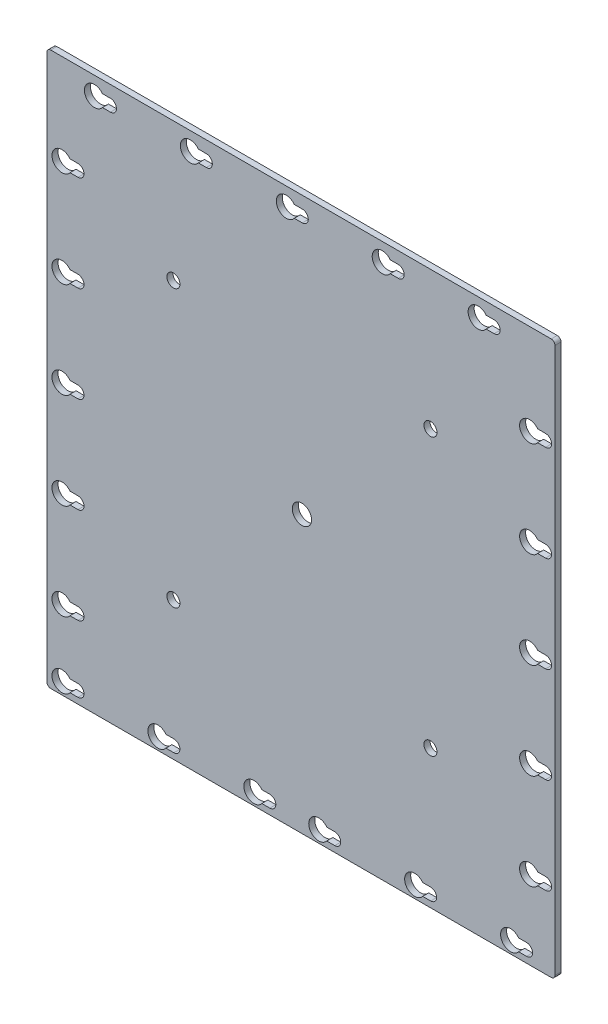
from build123d import *

# Parameters (mm, degrees)
SKETCH1_W               = 135.01974
SKETCH1_H               = 146.431289
SKETCH1_R               = 2.5527
BOSS_EXTRUDE1_DEPTH     = 1.6
SKETCH3_W               = 0.5
SKETCH3_H               = 146.431289
CUT_EXTRUDE1_DEPTH      = 1.6
FILLET1_R               = 1
CUT_EXTRUDE2_DEPTH      = 199.847285241
CUT_EXTRUDE2_DEPTH_BACK = 199.847285241
SKETCH4_R               = 1.725


with BuildPart() as part:
    # Sketch1 → Boss-Extrude1 (new body)
    with BuildSketch(Plane.XY):
        with Locations((67.50987, -73.2156445)):
            Rectangle(SKETCH1_W, SKETCH1_H)
        with BuildLine():
            Line((65.489272699, -3.175), (67.6049, -3.175))
            ThreePointArc((67.6049, -3.175), (69.1924, -4.7625), (67.6049, -6.35))
            Line((67.6049, -6.35), (65.489272699, -6.35))
            ThreePointArc((65.489272699, -6.35), (60.7174, -4.7625), (65.489272699, -3.175))
        make_face(mode=Mode.SUBTRACT)
        with Locations((67.50987, -73.2156445)):
            Circle(SKETCH1_R, mode=Mode.SUBTRACT)
        with BuildLine():
            Line((6.094272699, -141.668789), (8.2099, -141.668789))
            ThreePointArc((8.2099, -141.668789), (9.7974, -143.256289), (8.2099, -144.843789))
            Line((8.2099, -144.843789), (6.094272699, -144.843789))
            ThreePointArc((6.094272699, -144.843789), (1.3224, -143.256289), (6.094272699, -141.668789))
        make_face(mode=Mode.SUBTRACT)
        with BuildLine():
            Line((31.494272699, -141.668789), (33.6099, -141.668789))
            ThreePointArc((33.6099, -141.668789), (35.1974, -143.256289), (33.6099, -144.843789))
            Line((33.6099, -144.843789), (31.494272699, -144.843789))
            ThreePointArc((31.494272699, -144.843789), (26.7224, -143.256289), (31.494272699, -141.668789))
        make_face(mode=Mode.SUBTRACT)
        with BuildLine():
            Line((6.094244639, -124.015625), (8.20987194, -124.015625))
            ThreePointArc((8.20987194, -124.015625), (9.79737194, -125.603125), (8.20987194, -127.190625))
            Line((8.20987194, -127.190625), (6.094244639, -127.190625))
            ThreePointArc((6.094244639, -127.190625), (1.32237194, -125.603125), (6.094244639, -124.015625))
        make_face(mode=Mode.SUBTRACT)
        with BuildLine():
            Line((56.894272699, -141.668789), (59.0099, -141.668789))
            ThreePointArc((59.0099, -141.668789), (60.5974, -143.256289), (59.0099, -144.843789))
            Line((59.0099, -144.843789), (56.894272699, -144.843789))
            ThreePointArc((56.894272699, -144.843789), (52.1224, -143.256289), (56.894272699, -141.668789))
        make_face(mode=Mode.SUBTRACT)
        with BuildLine():
            Line((6.094244639, -98.615625), (8.20987194, -98.615625))
            ThreePointArc((8.20987194, -98.615625), (9.79737194, -100.203125), (8.20987194, -101.790625))
            Line((8.20987194, -101.790625), (6.094244639, -101.790625))
            ThreePointArc((6.094244639, -101.790625), (1.32237194, -100.203125), (6.094244639, -98.615625))
        make_face(mode=Mode.SUBTRACT)
        with BuildLine():
            Line((6.094244639, -73.215625), (8.20987194, -73.215625))
            ThreePointArc((8.20987194, -73.215625), (9.79737194, -74.803125), (8.20987194, -76.390625))
            Line((8.20987194, -76.390625), (6.094244639, -76.390625))
            ThreePointArc((6.094244639, -76.390625), (1.32237194, -74.803125), (6.094244639, -73.215625))
        make_face(mode=Mode.SUBTRACT)
        with BuildLine():
            Line((6.094244639, -47.815625), (8.20987194, -47.815625))
            ThreePointArc((8.20987194, -47.815625), (9.79737194, -49.403125), (8.20987194, -50.990625))
            Line((8.20987194, -50.990625), (6.094244639, -50.990625))
            ThreePointArc((6.094244639, -50.990625), (1.32237194, -49.403125), (6.094244639, -47.815625))
        make_face(mode=Mode.SUBTRACT)
        with BuildLine():
            Line((6.094244639, -22.415625), (8.20987194, -22.415625))
            ThreePointArc((8.20987194, -22.415625), (9.79737194, -24.003125), (8.20987194, -25.590625))
            Line((8.20987194, -25.590625), (6.094244639, -25.590625))
            ThreePointArc((6.094244639, -25.590625), (1.32237194, -24.003125), (6.094244639, -22.415625))
        make_face(mode=Mode.SUBTRACT)
        with BuildLine():
            Line((14.689272699, -3.175), (16.8049, -3.175))
            ThreePointArc((16.8049, -3.175), (18.3924, -4.7625), (16.8049, -6.35))
            Line((16.8049, -6.35), (14.689272699, -6.35))
            ThreePointArc((14.689272699, -6.35), (9.9174, -4.7625), (14.689272699, -3.175))
        make_face(mode=Mode.SUBTRACT)
        with BuildLine():
            Line((40.089272699, -3.175), (42.2049, -3.175))
            ThreePointArc((42.2049, -3.175), (43.7924, -4.7625), (42.2049, -6.35))
            Line((42.2049, -6.35), (40.089272699, -6.35))
            ThreePointArc((40.089272699, -6.35), (35.3174, -4.7625), (40.089272699, -3.175))
        make_face(mode=Mode.SUBTRACT)
        with BuildLine():
            Line((118.4049, -6.35), (116.289272699, -6.35))
            ThreePointArc((116.289272699, -6.35), (111.5174, -4.7625), (116.289272699, -3.175))
            Line((116.289272699, -3.175), (118.4049, -3.175))
            ThreePointArc((118.4049, -3.175), (119.9924, -4.7625), (118.4049, -6.35))
        make_face(mode=Mode.SUBTRACT)
        with BuildLine():
            Line((76.20003, -144.843789), (74.084402699, -144.843789))
            ThreePointArc((74.084402699, -144.843789), (69.31253, -143.256289), (74.084402699, -141.668789))
            Line((74.084402699, -141.668789), (76.20003, -141.668789))
            ThreePointArc((76.20003, -141.668789), (77.78753, -143.256289), (76.20003, -144.843789))
        make_face(mode=Mode.SUBTRACT)
        with BuildLine():
            Line((99.484402699, -141.668789), (101.60003, -141.668789))
            ThreePointArc((101.60003, -141.668789), (103.18753, -143.256289), (101.60003, -144.843789))
            Line((101.60003, -144.843789), (99.484402699, -144.843789))
            ThreePointArc((99.484402699, -144.843789), (94.71253, -143.256289), (99.484402699, -141.668789))
        make_face(mode=Mode.SUBTRACT)
        with BuildLine():
            Line((124.884402699, -141.668789), (127.00003, -141.668789))
            ThreePointArc((127.00003, -141.668789), (128.58753, -143.256289), (127.00003, -144.843789))
            Line((127.00003, -144.843789), (124.884402699, -144.843789))
            ThreePointArc((124.884402699, -144.843789), (120.11253, -143.256289), (124.884402699, -141.668789))
        make_face(mode=Mode.SUBTRACT)
        with BuildLine():
            Line((129.919244699, -124.015625), (132.034872, -124.015625))
            ThreePointArc((132.034872, -124.015625), (133.622372, -125.603125), (132.034872, -127.190625))
            Line((132.034872, -127.190625), (129.919244699, -127.190625))
            ThreePointArc((129.919244699, -127.190625), (125.147372, -125.603125), (129.919244699, -124.015625))
        make_face(mode=Mode.SUBTRACT)
        with BuildLine():
            Line((129.919244699, -98.615625), (132.034872, -98.615625))
            ThreePointArc((132.034872, -98.615625), (133.622372, -100.203125), (132.034872, -101.790625))
            Line((132.034872, -101.790625), (129.919244699, -101.790625))
            ThreePointArc((129.919244699, -101.790625), (125.147372, -100.203125), (129.919244699, -98.615625))
        make_face(mode=Mode.SUBTRACT)
        with BuildLine():
            Line((129.919244699, -73.215625), (132.034872, -73.215625))
            ThreePointArc((132.034872, -73.215625), (133.622372, -74.803125), (132.034872, -76.390625))
            Line((132.034872, -76.390625), (129.919244699, -76.390625))
            ThreePointArc((129.919244699, -76.390625), (125.147372, -74.803125), (129.919244699, -73.215625))
        make_face(mode=Mode.SUBTRACT)
        with BuildLine():
            Line((129.919244699, -47.815625), (132.034872, -47.815625))
            ThreePointArc((132.034872, -47.815625), (133.622372, -49.403125), (132.034872, -50.990625))
            Line((132.034872, -50.990625), (129.919244699, -50.990625))
            ThreePointArc((129.919244699, -50.990625), (125.147372, -49.403125), (129.919244699, -47.815625))
        make_face(mode=Mode.SUBTRACT)
        with BuildLine():
            Line((90.889272699, -3.175), (93.0049, -3.175))
            ThreePointArc((93.0049, -3.175), (94.5924, -4.7625), (93.0049, -6.35))
            Line((93.0049, -6.35), (90.889272699, -6.35))
            ThreePointArc((90.889272699, -6.35), (86.1174, -4.7625), (90.889272699, -3.175))
        make_face(mode=Mode.SUBTRACT)
        with BuildLine():
            Line((129.919244699, -22.415625), (132.034872, -22.415625))
            ThreePointArc((132.034872, -22.415625), (133.622372, -24.003125), (132.034872, -25.590625))
            Line((132.034872, -25.590625), (129.919244699, -25.590625))
            ThreePointArc((129.919244699, -25.590625), (125.147372, -24.003125), (129.919244699, -22.415625))
        make_face(mode=Mode.SUBTRACT)
    extrude(amount=BOSS_EXTRUDE1_DEPTH)

    # Sketch3 → Cut-Extrude1 (cut)
    with BuildSketch(Plane.XY.offset(1.6)):
        with Locations((134.76974, -73.2156445)):
            Rectangle(SKETCH3_W, SKETCH3_H)
    extrude(amount=-CUT_EXTRUDE1_DEPTH, mode=Mode.SUBTRACT)

    # Fillet1
    fillet1_edges = [part.edges().sort_by_distance(p)[0] for p in [
        (0, -146.431289, 0.8),
        (0, 0, 0.8),
        (134.51974, 0, 0.8),
        (134.51974, -146.431289, 0.8),
    ]]
    fillet(fillet1_edges, radius=FILLET1_R)

    # Sketch4 → Cut-Extrude2 (cut, two sides: drawn at the far end of the back side and taken through both)
    with BuildSketch(Plane.XY.offset(1.6).offset(-CUT_EXTRUDE2_DEPTH_BACK)):
        with Locations((33.479935, -36.60782225)):
            Circle(SKETCH4_R)
        with Locations((101.539805, -36.60782225)):
            Circle(SKETCH4_R)
        with Locations((101.539805, -109.82346675)):
            Circle(SKETCH4_R)
        with Locations((33.479935, -109.82346675)):
            Circle(SKETCH4_R)
    extrude(amount=CUT_EXTRUDE2_DEPTH + CUT_EXTRUDE2_DEPTH_BACK, mode=Mode.SUBTRACT)


solid = part.part
